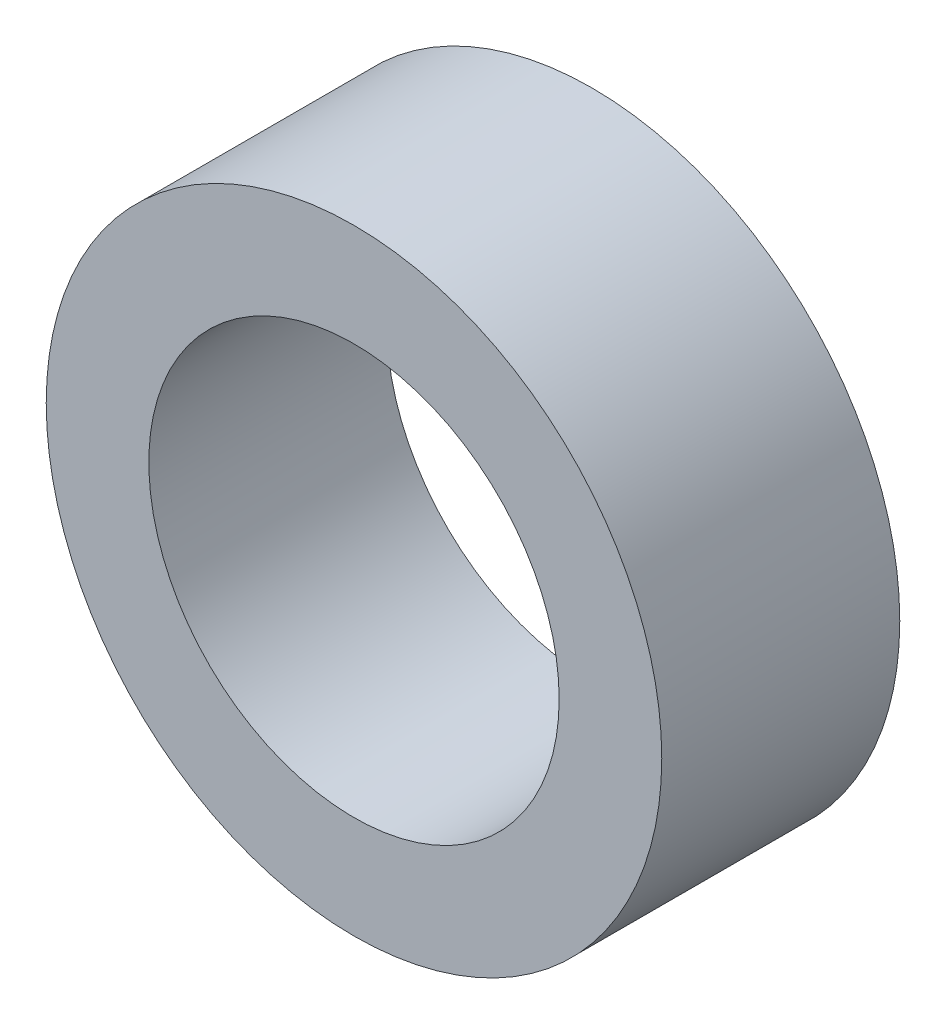
from build123d import *

# Parameters (mm, degrees)
SKETCH1_R           = 7.5
SKETCH1_R_2         = 5
BOSS_EXTRUDE1_DEPTH = 5.8


with BuildPart() as part:
    # Sketch1 → Boss-Extrude1 (new body)
    with BuildSketch(Plane.XY):
        Circle(SKETCH1_R)
        Circle(SKETCH1_R_2, mode=Mode.SUBTRACT)
    extrude(amount=BOSS_EXTRUDE1_DEPTH)


solid = part.part
